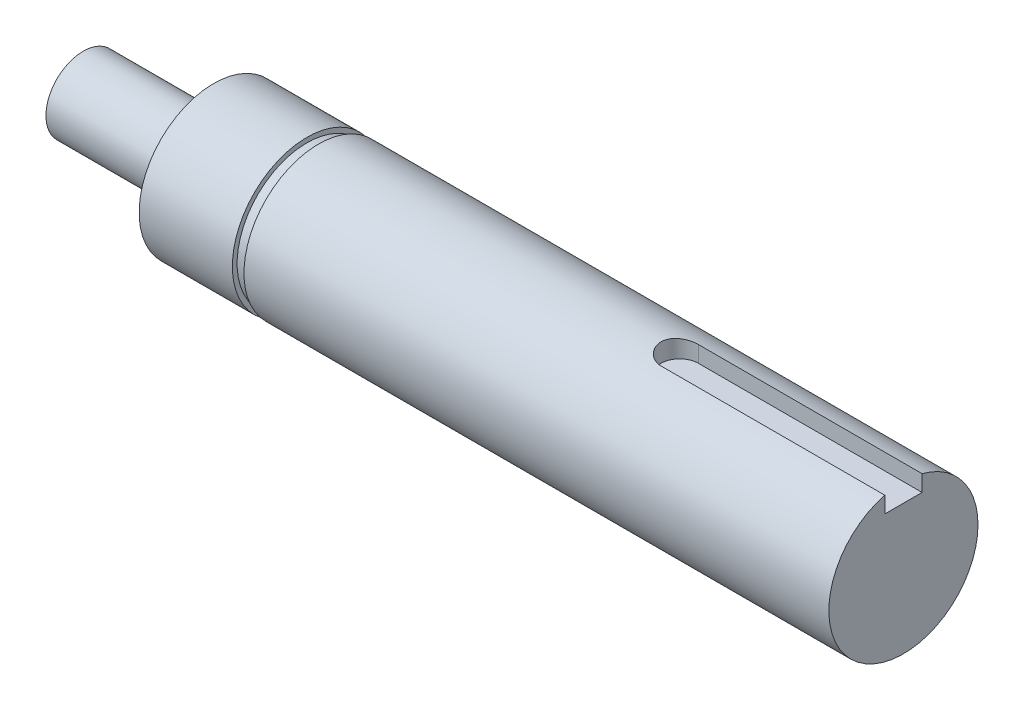
from build123d import *

# Parameters (mm, degrees)
CUT_EXTRUDE1_DEPTH = 1.5875


with BuildPart() as part:
    # Sketch1 → Revolve1 (revolve)
    with BuildSketch(Plane.XY, mode=Mode.PRIVATE) as revolve1_sk:
        Polygon((-69.85, 0), (-69.85, 3.175), (-58.7375, 3.175), (-58.7375, 6.35), (-50.8, 6.35), (-50.8, 5.9436), (-49.8094, 5.9436), (-49.8094, 6.35), (0, 6.35), (0, 0), align=None)
    revolve(revolve1_sk.sketch.rotate(Axis((0, 0, 0), (-1, 0, 0)), 90), axis=Axis((0, 0, 0), (-1, 0, 0)))

    # Sketch2 → Cut-Extrude1 (cut)
    with BuildSketch(Plane(origin=(0, 6.35, 0), x_dir=(-1, 0, 0), z_dir=(0, 1, 0))):
        with BuildLine():
            Line((19.05, 1.5875), (0, 1.5875))
            Line((0, 1.5875), (0, -1.5875))
            Line((0, -1.5875), (19.05, -1.5875))
            ThreePointArc((19.05, -1.5875), (20.6375, 0), (19.05, 1.5875))
        make_face()
    extrude(amount=-CUT_EXTRUDE1_DEPTH, mode=Mode.SUBTRACT)


solid = part.part
